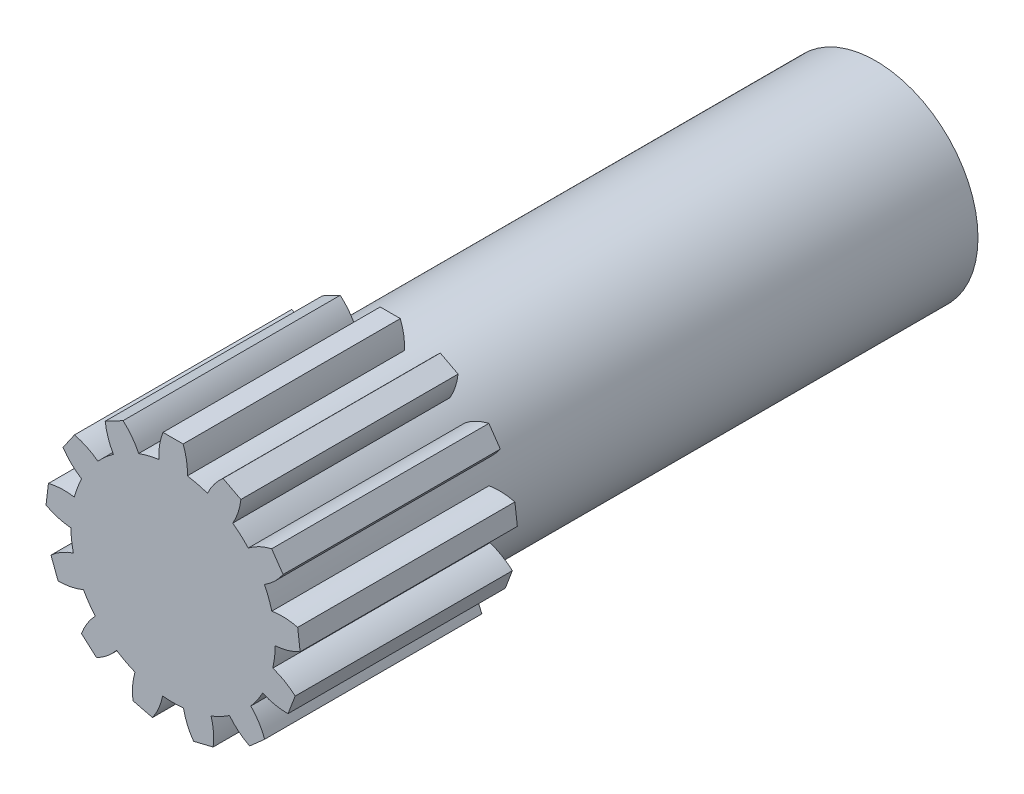
from build123d import *

# Parameters (mm, degrees)
SKETCH1_R           = 8
BOSS_EXTRUDE1_DEPTH = 55
BOSS_EXTRUDE2_START = -17
BOSS_EXTRUDE2_DEPTH = 17
CIRPATTERN1_COUNT   = 13


with BuildPart() as part:
    # Sketch1 → Boss-Extrude1 (new body)
    with BuildSketch(Plane.XY):
        Circle(SKETCH1_R)
    extrude(amount=BOSS_EXTRUDE1_DEPTH)

    # Sketch2 → Boss-Extrude2 (add)
    with BuildSketch(Plane.XY.offset(55).offset(BOSS_EXTRUDE2_START)):
        with BuildLine():
            Line((-0.787121101, 9.92163467), (0.787121101, 9.92163467))
            ThreePointArc((0.787121101, 9.92163467), (1.056170344, 8.938993112), (1.115168142, 7.921893714))
            ThreePointArc((1.115168142, 7.921893714), (0, 8), (-1.115168142, 7.921893714))
            ThreePointArc((-1.115168142, 7.921893714), (-1.056170344, 8.938993112), (-0.787121101, 9.92163467))
        make_face()
    boss_extrude2 = extrude(amount=BOSS_EXTRUDE2_DEPTH)

    # CirPattern1: Boss-Extrude2 ×13 about axis
    cirpattern1_axis = Axis((0, 0, 0), (0, 0, 1))
    for i in range(1, CIRPATTERN1_COUNT):
        add(boss_extrude2.rotate(cirpattern1_axis, i * 360 / CIRPATTERN1_COUNT))


solid = part.part
